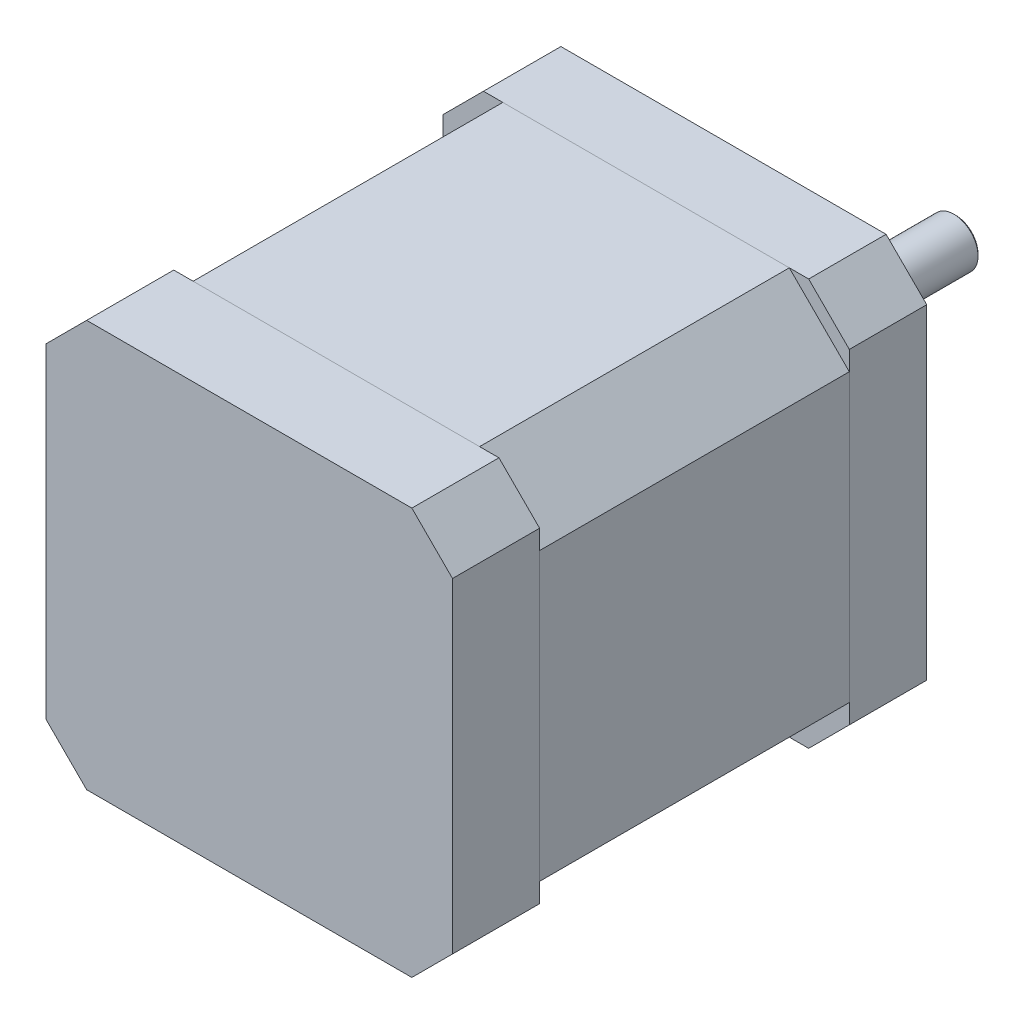
from build123d import *

# Parameters (mm, degrees)
ESQUISSE1_W             = 42
ESQUISSE1_H             = 42
BOSS_EXTRU_1_DEPTH      = 8
CHANFREIN1_SIZE         = 4.2
BOSS_EXTRU_2_DEPTH      = 32
ESQUISSE4_W             = 42
ESQUISSE4_H             = 42
BOSS_EXTRU_3_DEPTH      = 9
CHANFREIN3_SIZE         = 4.2
ESQUISSE5_R             = 11
BOSS_EXTRU_4_DEPTH      = 2
ESQUISSE6_R             = 4.5
ENL_V_MAT_EXTRU_1_DEPTH = 3
ESQUISSE7_R             = 2.5
BOSS_EXTRU_5_DEPTH      = 25
CHANFREIN4_SIZE         = 0.2
ESQUISSE8_R             = 1.5
ENL_V_MAT_EXTRU_2_DEPTH = 5
CHANFREIN5_SIZE         = 0.2
ESQUISSE9_W             = 7
ESQUISSE9_H             = 8
ENL_V_MAT_EXTRU_3_DEPTH = 2


with BuildPart() as part:
    # Esquisse1 → Boss.-Extru.1 (new body)
    with BuildSketch(Plane.XY):
        Rectangle(ESQUISSE1_W, ESQUISSE1_H)
    extrude(amount=BOSS_EXTRU_1_DEPTH)

    # Chanfrein1
    chanfrein1_edges = [part.edges().sort_by_distance(p)[0] for p in [
        (21, -21, 4),
        (-21, -21, 4),
        (-21, 21, 4),
        (21, 21, 4),
    ]]
    chamfer(chanfrein1_edges, length=CHANFREIN1_SIZE)

    # Esquisse5 → Boss.-Extru.4 (add)
    with BuildSketch(Plane(origin=(0, 0, 0), x_dir=(-1, 0, 0), z_dir=(0, 0, -1))):
        with Locations(Location((0, 0, 0), (0, 0, 180))):
            Circle(ESQUISSE5_R)
    extrude(amount=BOSS_EXTRU_4_DEPTH)

    # Esquisse6 → Enlèv. mat.-Extru.1 (cut)
    with BuildSketch(Plane(origin=(0, 0, -2), x_dir=(-1, 0, 0), z_dir=(0, 0, -1))):
        Circle(ESQUISSE6_R)
    extrude(amount=-ENL_V_MAT_EXTRU_1_DEPTH, mode=Mode.SUBTRACT)

    # Esquisse7 → Boss.-Extru.5 (add)
    with BuildSketch(Plane(origin=(0, 0, 1), x_dir=(-1, 0, 0), z_dir=(0, 0, -1))):
        Circle(ESQUISSE7_R)
    extrude(amount=BOSS_EXTRU_5_DEPTH)

    # Chanfrein4
    chanfrein4_edges = [part.edges().sort_by_distance(p)[0] for p in [
        (2.5, 0, -24),
    ]]
    chamfer(chanfrein4_edges, length=CHANFREIN4_SIZE)

    # Esquisse8 → Enlèv. mat.-Extru.2 (cut)
    with BuildSketch(Plane(origin=(0, 0, 0), x_dir=(-1, 0, 0), z_dir=(0, 0, -1))):
        with Locations((-15.5, 15.5)):
            Circle(ESQUISSE8_R)
        with Locations((15.5, 15.5)):
            Circle(ESQUISSE8_R)
        with Locations((15.5, -15.5)):
            Circle(ESQUISSE8_R)
        with Locations((-15.5, -15.5)):
            Circle(ESQUISSE8_R)
    extrude(amount=-ENL_V_MAT_EXTRU_2_DEPTH, mode=Mode.SUBTRACT)

    # Chanfrein5
    chanfrein5_edges = [part.edges().sort_by_distance(p)[0] for p in [
        (17, 15.5, 0),
        (-14, 15.5, 0),
        (-14, -15.5, 0),
        (17, -15.5, 0),
    ]]
    chamfer(chanfrein5_edges, length=CHANFREIN5_SIZE)


with BuildPart() as body_2:
    # Esquisse3 → Boss.-Extru.2 (new body)
    with BuildSketch(Plane.XY.offset(8)):
        Polygon((-21, 14.8), (-14.8, 21), (14.8, 21), (21, 14.8), (21, -14.8), (14.8, -21), (-14.8, -21), (-21, -14.8), align=None)
    extrude(amount=BOSS_EXTRU_2_DEPTH)


with BuildPart() as body_3:
    # Esquisse4 → Boss.-Extru.3 (new body)
    with BuildSketch(Plane.XY.offset(40)):
        Rectangle(ESQUISSE4_W, ESQUISSE4_H)
    extrude(amount=BOSS_EXTRU_3_DEPTH)

    # Chanfrein3
    chanfrein3_edges = [body_3.edges().sort_by_distance(p)[0] for p in [
        (21, -21, 44.5),
        (-21, -21, 44.5),
        (-21, 21, 44.5),
        (21, 21, 44.5),
    ]]
    chamfer(chanfrein3_edges, length=CHANFREIN3_SIZE)

    # Esquisse9 → Enlèv. mat.-Extru.3 (cut)
    with BuildSketch(Plane.ZY.offset(21)):
        with Locations((43.5, 0)):
            Rectangle(ESQUISSE9_W, ESQUISSE9_H)
    extrude(amount=-ENL_V_MAT_EXTRU_3_DEPTH, mode=Mode.SUBTRACT)


solid = Compound([part.part, body_2.part, body_3.part])
